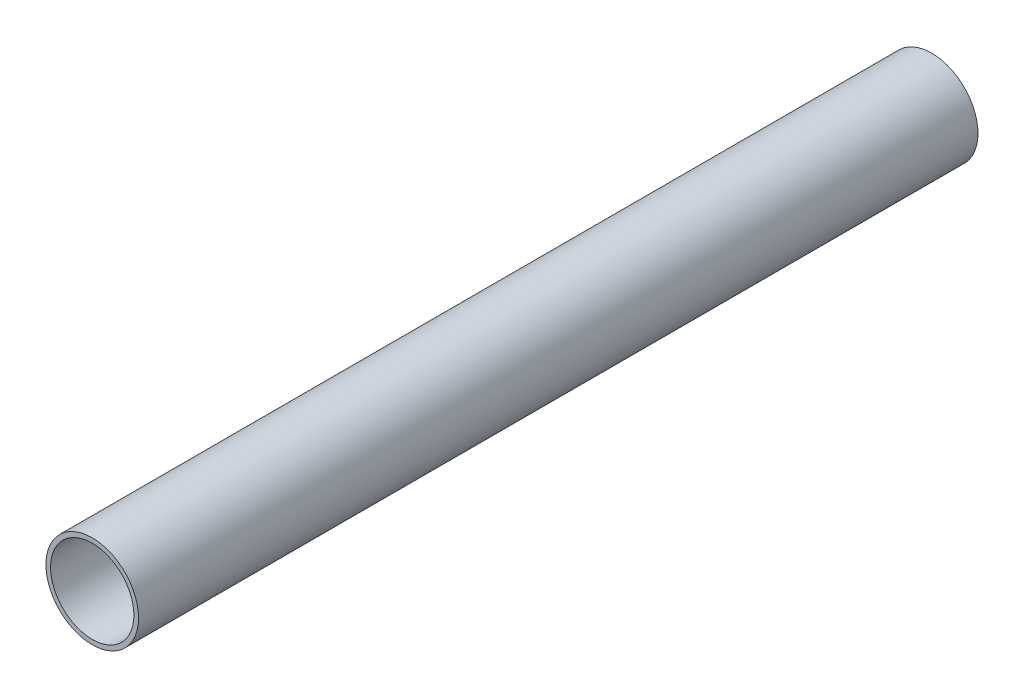
from build123d import *

# Parameters (mm, degrees)
SKETCH1_R           = 8
SKETCH1_R_2         = 7.2
BOSS_EXTRUDE1_DEPTH = 72.5


with BuildPart() as part:
    # Sketch1 → Boss-Extrude1 (new, symmetric)
    with BuildSketch(Plane.XY):
        Circle(SKETCH1_R)
        Circle(SKETCH1_R_2, mode=Mode.SUBTRACT)
    extrude(amount=BOSS_EXTRUDE1_DEPTH, both=True)


solid = part.part
